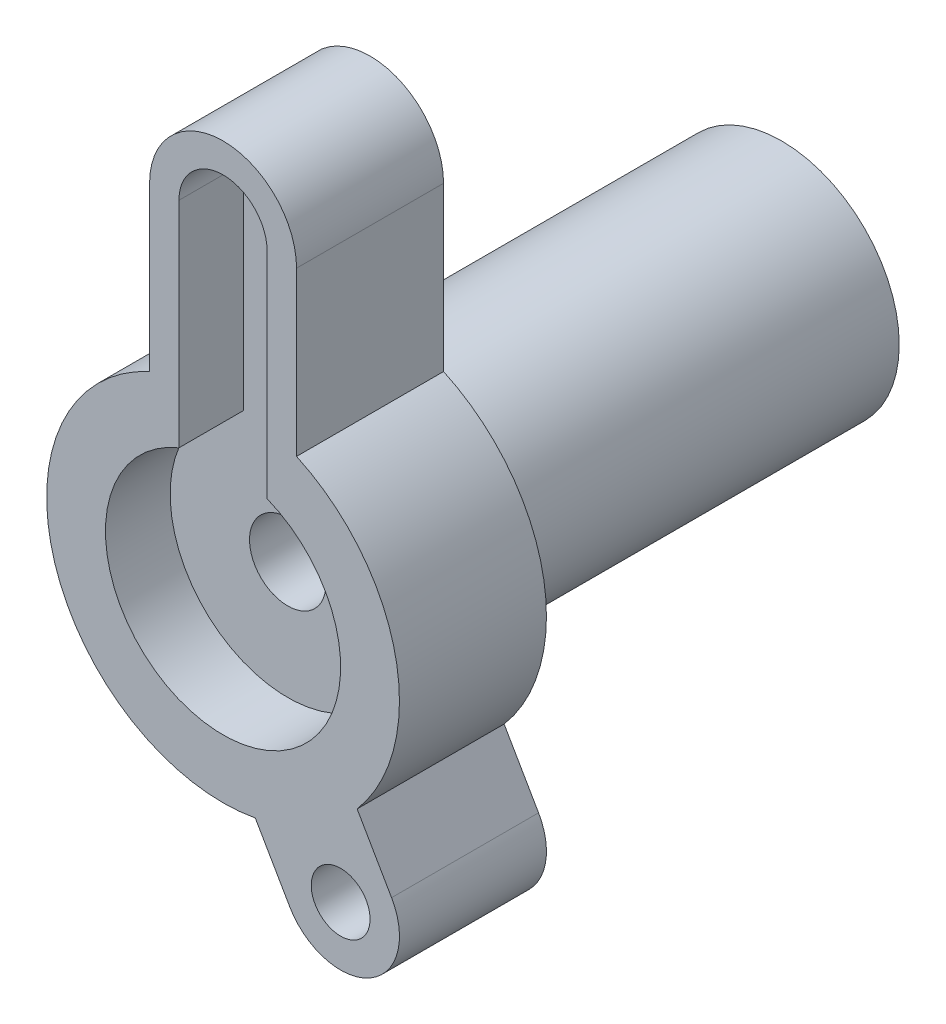
from build123d import *

# Parameters (mm, degrees)
SKETCH_1_R      = 20
SKETCH_1_R_2    = 6.5
EXTRUDE_1_DEPTH = 70
EXTRUDE_2_DEPTH = 25
SKETCH_2_4_R    = 6.5
EXTRUDE_4_DEPTH = 1
EXTRUDE_START   = -25
SKETCH_3_R      = 5
EXTRUDE_5_DEPTH = 25
SKETCH_4_R      = 6.5
EXTRUDE_6_DEPTH = 13


with BuildPart() as part:
    # Эскиз1 → Бобышка-Вытянуть1 (new body)
    with BuildSketch(Plane.XY):
        Circle(SKETCH_1_R)
        Circle(SKETCH_1_R_2, mode=Mode.SUBTRACT)
    extrude(amount=EXTRUDE_1_DEPTH)



with BuildPart() as body_2:
    # Эскиз2 → Бобышка-Вытянуть2 (new body)
    with BuildSketch(Plane.XY.offset(70)):
        with BuildLine():
            ThreePointArc((20, 0), (-8.660254038, -18.027756377), (-12.5, 15.612494996))
            Line((-12.5, 15.612494996), (-12.5, 27.271780287))
            ThreePointArc((-12.5, 27.271780287), (-16.201851746, -25.248762346), (30, 0))
            ThreePointArc((30, 0), (25.248762346, 16.201851746), (12.5, 27.271780287))
            Line((12.5, 27.271780287), (12.5, 15.612494996))
            ThreePointArc((12.5, 15.612494996), (18.027756377, 8.660254038), (20, 0))
        make_face()
        with BuildLine():
            Line((-12.5, 27.271780287), (-12.5, 15.612494996))
            ThreePointArc((-12.5, 15.612494996), (-10.106596746, 17.258525494), (-7.5, 18.540496218))
            Line((-7.5, 18.540496218), (-7.5, 29.047375097))
            ThreePointArc((-7.5, 29.047375097), (-10.039331862, 28.270334554), (-12.5, 27.271780287))
        make_face()
        with BuildLine():
            ThreePointArc((7.5, 18.540496218), (10.106596746, 17.258525494), (12.5, 15.612494996))
            Line((12.5, 15.612494996), (12.5, 27.271780287))
            ThreePointArc((12.5, 27.271780287), (10.039331862, 28.270334554), (7.5, 29.047375097))
            Line((7.5, 29.047375097), (7.5, 18.540496218))
        make_face()
        with BuildLine():
            Line((-12.5, 55), (-12.5, 27.271780287))
            ThreePointArc((-12.5, 27.271780287), (-10.039331862, 28.270334554), (-7.5, 29.047375097))
            Line((-7.5, 29.047375097), (-7.5, 55))
            ThreePointArc((-7.5, 55), (0, 62.5), (7.5, 55))
            Line((7.5, 55), (7.5, 29.047375097))
            ThreePointArc((7.5, 29.047375097), (10.039331862, 28.270334554), (12.5, 27.271780287))
            Line((12.5, 27.271780287), (12.5, 55))
            ThreePointArc((12.5, 55), (0, 67.5), (-12.5, 55))
        make_face()
    extrude(amount=EXTRUDE_2_DEPTH)


with BuildPart() as part_1:
    add(part.part)

    add(body_2.part)  # Бобышка-Вытянуть4 merges body 2
    # Эскиз2<4> → Бобышка-Вытянуть4 (add)
    with BuildSketch(Plane.XY.offset(70)):
        with BuildLine():
            Line((7.5, 18.540496218), (7.5, 55))
            ThreePointArc((7.5, 55), (0, 62.5), (-7.5, 55))
            Line((-7.5, 55), (-7.5, 18.540496218))
            ThreePointArc((-7.5, 18.540496218), (0, -20), (7.5, 18.540496218))
        make_face()
        Circle(SKETCH_2_4_R, mode=Mode.SUBTRACT)
    extrude(amount=EXTRUDE_4_DEPTH)

    # Эскиз3 → Бобышка-Вытянуть5 (add)
    with BuildSketch(Plane.XY.offset(95).offset(EXTRUDE_START)):
        with BuildLine():
            Line((28.660254038, -29.641016151), (22.802389662, -19.494897428))
            ThreePointArc((22.802389662, -19.494897428), (15, -25.980762114), (5.481881586, -29.494897428))
            Line((5.481881586, -29.494897428), (11.339745962, -39.641016151))
            ThreePointArc((11.339745962, -39.641016151), (25, -43.301270189), (28.660254038, -29.641016151))
        make_face()
        with Locations((20, -34.641016151)):
            Circle(SKETCH_3_R, mode=Mode.SUBTRACT)
    extrude(amount=EXTRUDE_5_DEPTH)

    # Эскиз4 → Бобышка-Вытянуть6 (add)
    with BuildSketch(Plane.XY.offset(71)):
        with BuildLine():
            Line((7.5, 18.540496218), (7.5, 55))
            ThreePointArc((7.5, 55), (0, 62.5), (-7.5, 55))
            Line((-7.5, 55), (-7.5, 18.540496218))
            ThreePointArc((-7.5, 18.540496218), (0, -20), (7.5, 18.540496218))
        make_face()
        Circle(SKETCH_4_R, mode=Mode.SUBTRACT)
    extrude(amount=EXTRUDE_6_DEPTH)


solid = part_1.part
